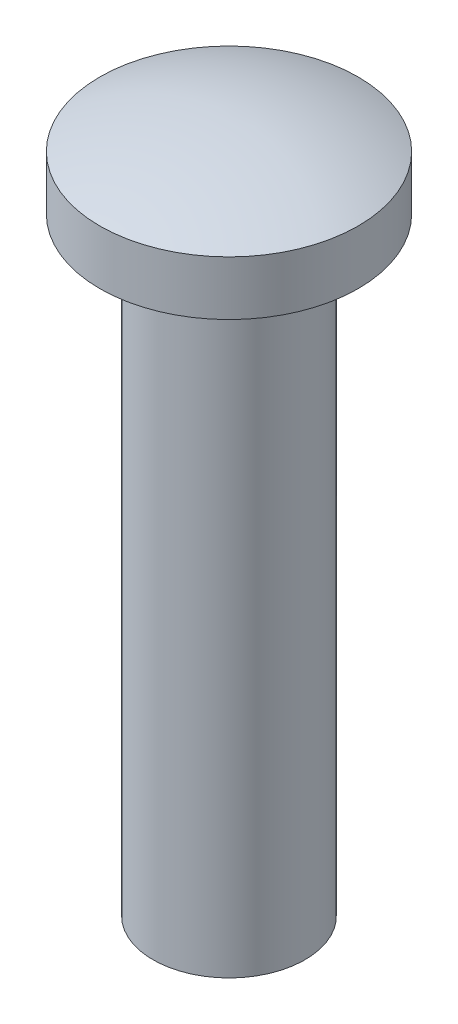
from build123d import *


with BuildPart() as part:
    # 草圖1 → 旋轉1 (revolve)
    with BuildSketch(Plane.XY, mode=Mode.PRIVATE) as revolve_1_sk:
        with BuildLine():
            Line((0, 0), (0, 4.538239362))
            ThreePointArc((0, 4.538239362), (-0.434530519, 4.492483378), (-0.85, 4.357222549))
            Line((-0.85, 4.357222549), (-0.85, 4))
            Line((-0.85, 4), (-0.5, 4))
            Line((-0.5, 4), (-0.5, 0))
            Line((-0.5, 0), (0, 0))
        make_face()
    revolve(revolve_1_sk.sketch.rotate(Axis((0, 0, 0), (0, 1, 0)), 270), axis=Axis((0, 0, 0), (0, 1, 0)))


solid = part.part
